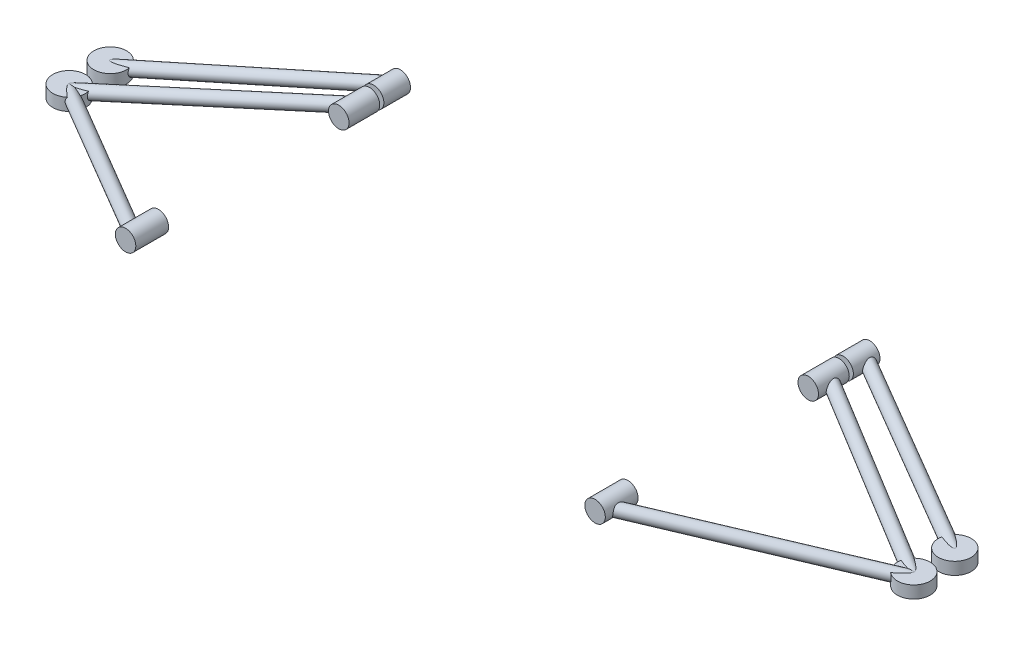
from build123d import *

# Parameters (mm, degrees)
SKETCH2_R           = 12.5
BOSS_EXTRUDE1_DEPTH = 40
SKETCH3_R           = 12.5
BOSS_EXTRUDE2_DEPTH = 37.5
SKETCH4_R           = 12.5
BOSS_EXTRUDE3_DEPTH = 32.5
SKETCH1_R           = 20
SKETCH1_R_2         = 12.5
BOSS_EXTRUDE4_DEPTH = 7.5
SWEEP1_PROFILE_R    = 7.5
SWEEP2_PROFILE_R    = 7.5


with BuildPart() as part:
    # Sketch2 → Boss-Extrude1 (new body)
    with BuildSketch(Plane(origin=(0, 0, -1475), x_dir=(-1, 0, 0), z_dir=(0, 0, -1))):
        with Locations(Location((-286.3, 182.577968064, 0), (0, 0, 180))):
            Circle(SKETCH2_R)
    extrude(amount=BOSS_EXTRUDE1_DEPTH)



with BuildPart() as body_2:
    # Sketch3 → Boss-Extrude2 (new body)
    with BuildSketch(Plane(origin=(0, 0, -1735), x_dir=(-1, 0, 0), z_dir=(0, 0, -1))):
        with Locations(Location((-286.3, 182.577968064, 0), (0, 0, 180))):
            Circle(SKETCH3_R)
    extrude(amount=BOSS_EXTRUDE2_DEPTH)


with BuildPart() as body_3:
    # Sketch4 → Boss-Extrude3 (new body)
    with BuildSketch(Plane(origin=(0, 0, -1777.5), x_dir=(-1, 0, 0), z_dir=(0, 0, -1))):
        with Locations(Location((-286.3, 182.577968064, 0), (0, 0, 180))):
            Circle(SKETCH4_R)
    extrude(amount=BOSS_EXTRUDE3_DEPTH)


with BuildPart() as body_4:
    # Sketch1 → Boss-Extrude4 (new, symmetric)
    # profile 1 of 4: a face of its own
    with BuildSketch(Plane(origin=(0, 145.637091768, 0), x_dir=(1, 0, 0), z_dir=(0, 1, 0))):
        with Locations(Location((515.04415, 1634.995, 0), (0, 0, 270))):
            Circle(SKETCH1_R)
        with Locations((515.04415, 1634.995)):
            Circle(SKETCH1_R_2, mode=Mode.SUBTRACT)
    # profile 2 of 4: a face of its own
    with BuildSketch(Plane(origin=(0, 145.637091768, 0), x_dir=(1, 0, 0), z_dir=(0, 1, 0))):
        with Locations((515.04415, 1634.995)):
            Circle(SKETCH1_R_2)
    # profile 3 of 4: a face of its own
    with BuildSketch(Plane(origin=(0, 145.637091768, 0), x_dir=(1, 0, 0), z_dir=(0, 1, 0))):
        with Locations(Location((515.04415, 1684.995, 0), (0, 0, 270))):
            Circle(SKETCH1_R)
        with Locations((515.04415, 1684.995)):
            Circle(SKETCH1_R_2, mode=Mode.SUBTRACT)
    # profile 4 of 4: a face of its own
    with BuildSketch(Plane(origin=(0, 145.637091768, 0), x_dir=(1, 0, 0), z_dir=(0, 1, 0))):
        with Locations((515.04415, 1684.995)):
            Circle(SKETCH1_R_2)
    extrude(amount=BOSS_EXTRUDE4_DEPTH, both=True)


with BuildPart() as part_1:
    add(part.part)

    add(body_2.part)  # Sweep1 merges body 2

    add(body_4.part)  # Sweep1 merges body 4
    # Sweep1: sweep along a curve in space
    with BuildLine() as sweep1_path:
        Line((286.3, 182.577968064, -1485.235495663), (515.04415, 145.637091768, -1634.995))
        Line((515.04415, 145.637091768, -1634.995), (286.3, 182.577968064, -1759.921800316))
    # Sweep1 profile (on start of the path) → Sweep1 (sweep)
    with BuildSketch(Plane(origin=(286.3, 182.577968064, -1485.235495663), x_dir=(0.5477515059562297, 0, 0.8366410746088687), z_dir=(0.8291074332112854, -0.13389612423517772, -0.5428192075715375))):
        Circle(SWEEP1_PROFILE_R)
    sweep(path=sweep1_path.line, transition=Transition.RIGHT)


    add(body_3.part)  # Sweep2 merges body 3
    # Sweep2: sweep along a curve in space
    with BuildLine() as sweep2_path:
        Line((515.04415, 145.637091768, -1684.995), (286.3, 182.577968064, -1803.776495879))
    # Sweep2 profile (on start of the path) → Sweep2 (sweep)
    with BuildSketch(Plane(origin=(515.04415, 145.637091768, -1684.995), x_dir=(0.46084734191551585, 0, -0.8874794236766301), z_dir=(-0.8785024349203895, 0.14187313544085792, -0.45618580126865754))):
        Circle(SWEEP2_PROFILE_R)
    sweep(path=sweep2_path.line)


with BuildPart() as body_2_2:
    # Mirror1: mirrored copy
    add(part_1.part.mirror(Plane(origin=(0, 0, 0), x_dir=(0, 0, 1), z_dir=(1, 0, 0))))


solid = Compound([part_1.part, body_2_2.part])
